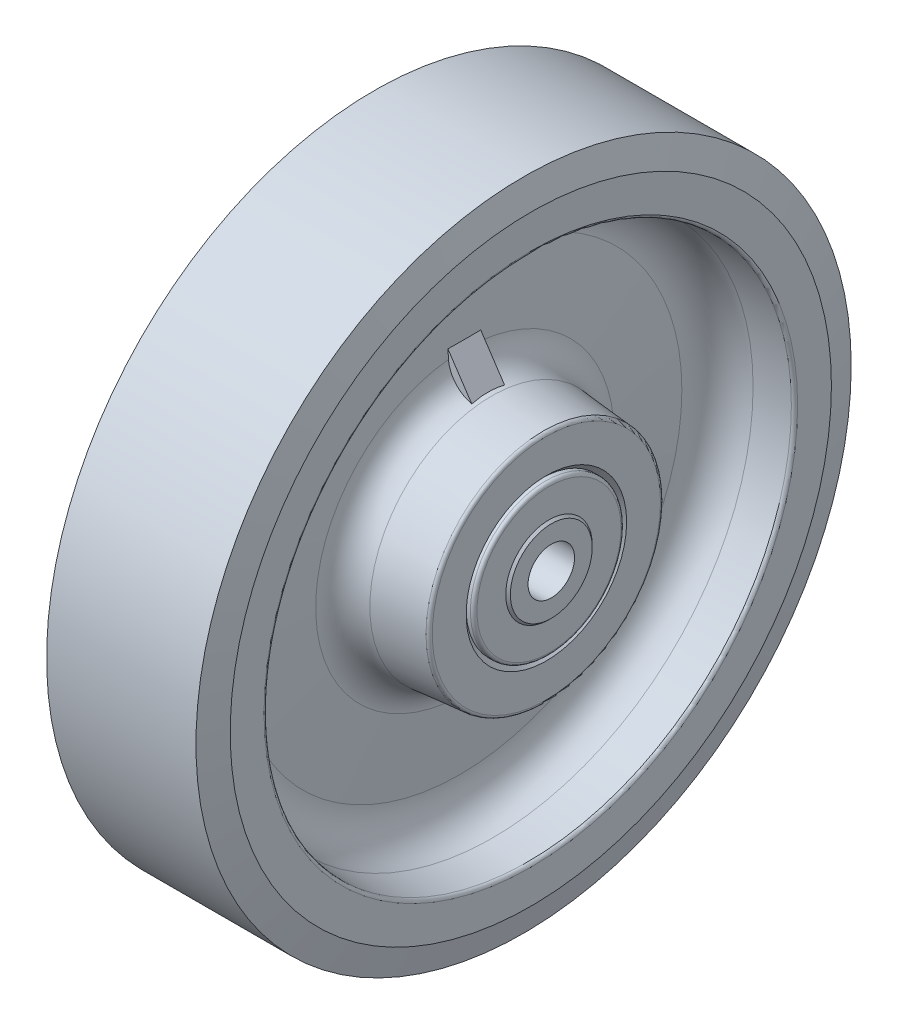
from build123d import *

# Parameters (mm, degrees)
ESTRUSIONE_ESTRUSIONE1_DEPTH = 5


with BuildPart() as part:
    # Schizzo1 → Rivoluzione1 (revolve)
    with BuildSketch(Plane.XY):
        with BuildLine():
            Line((22.79, 100), (-22.79, 100))
            Line((-22.79, 100), (-25.000314645, 91.750993443))
            Line((-25.000314645, 91.750993443), (-25.000314645, 81.439256466))
            ThreePointArc((-25.000314645, 81.439256466), (-24.737591982, 80.763666259), (-24.087470388, 80.443061768))
            Line((-24.087470388, 80.443061768), (-13.343866838, 79.503118252))
            ThreePointArc((-13.343866838, 79.503118252), (-5.938114386, 75.688905105), (-3.329375455, 67.777655362))
            Line((-3.329375455, 67.777655362), (-4.883801088, 45.548333164))
            ThreePointArc((-4.883801088, 45.548333164), (-7.442623498, 39.867958049), (-13.077475855, 37.210389145))
            Line((-13.077475855, 37.210389145), (-28.837155743, 35.831595814))
            ThreePointArc((-28.837155743, 35.831595814), (-29.487277337, 35.510991324), (-29.75, 34.835401116))
            Line((-29.75, 34.835401116), (-29.75, 24.5))
            Line((-29.75, 24.5), (-28.25, 23))
            Line((-28.25, 23), (-29.55, 23))
            ThreePointArc((-29.55, 23), (-30.257106781, 22.707106781), (-30.55, 22))
            Line((-30.55, 22), (-30.55, 13.2))
            Line((-30.55, 13.2), (-31.25, 12.5))
            Line((-31.25, 12.5), (-31.25, 7.095))
            Line((-31.25, 7.095), (-10.65, 7.095))
            Line((-10.65, 7.095), (-10.65, 10.495))
            Line((-10.65, 10.495), (10.65, 10.495))
            Line((10.65, 10.495), (10.65, 7.095))
            Line((10.65, 7.095), (31.25, 7.095))
            Line((31.25, 7.095), (31.25, 12.5))
            Line((31.25, 12.5), (30.55, 13.2))
            Line((30.55, 13.2), (30.55, 22))
            ThreePointArc((30.55, 22), (30.257106781, 22.707106781), (29.55, 23))
            Line((29.55, 23), (28.25, 23))
            Line((28.25, 23), (29.75, 24.5))
            Line((29.75, 24.5), (29.75, 34.835401116))
            ThreePointArc((29.75, 34.835401116), (29.487277337, 35.510991324), (28.837155743, 35.831595814))
            Line((28.837155743, 35.831595814), (13.077475855, 37.210389145))
            ThreePointArc((13.077475855, 37.210389145), (7.442623498, 39.867958049), (4.883801088, 45.548333164))
            Line((4.883801088, 45.548333164), (3.329375455, 67.777655362))
            ThreePointArc((3.329375455, 67.777655362), (5.938114386, 75.688905105), (13.343866838, 79.503118252))
            Line((13.343866838, 79.503118252), (24.087470388, 80.443061768))
            ThreePointArc((24.087470388, 80.443061768), (24.737591982, 80.763666259), (25.000314645, 81.439256466))
            Line((25.000314645, 81.439256466), (25.000314645, 91.750993443))
            Line((25.000314645, 91.750993443), (22.79, 100))
        make_face()
    revolve(axis=Axis((0, 0, 0), (-1, 0, 0)))

    # Schizzo3 → Estrusione-Estrusione1 (add, symmetric)
    with BuildSketch(Plane.XY):
        Polygon((0, 55), (-13.343866838, 35), (0, 35), align=None)
    estrusione_estrusione1 = extrude(amount=ESTRUSIONE_ESTRUSIONE1_DEPTH, both=True)

    # Specchia1: Estrusione-Estrusione1 across plane
    add(estrusione_estrusione1.mirror(Plane(origin=(0, 0, 0), x_dir=(0, 0, 1), z_dir=(1, 0, 0))))


solid = part.part
